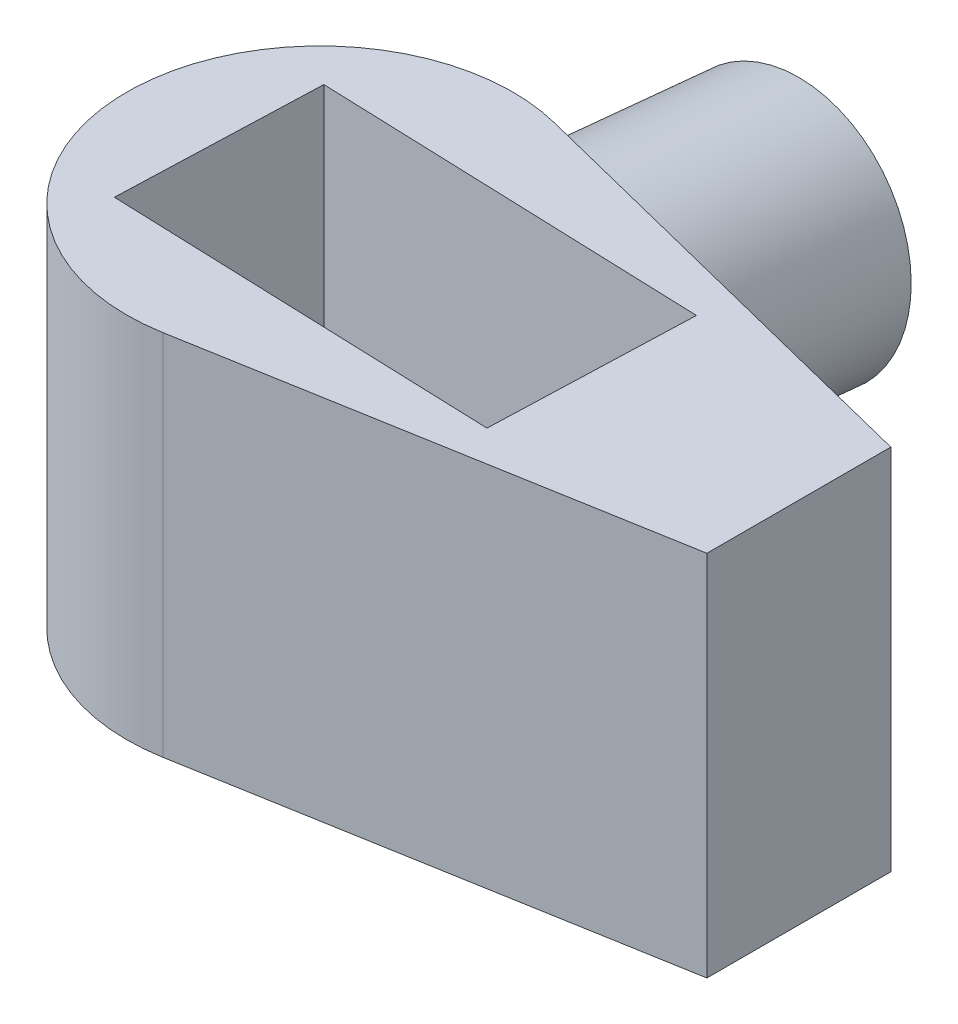
from build123d import *

# Parameters (mm, degrees)
CROQUIS1_R              = 21
SALIENTE_EXTRUIR1_DEPTH = 40
SALIENTE_EXTRUIR2_DEPTH = 40
SALIENTE_EXTRUIR3_REACH = 77.493
CROQUIS3_R              = 13.5
CROQUIS3_R_2            = 10
CROQUIS7_R              = 8.227269221
CROQUIS7_R_2            = 6
CORTAR_EXTRUIR6_DEPTH   = 6
CROQUIS8_R              = 6
CORTAR_EXTRUIR7_DEPTH   = 72.223648425
CORTAR_EXTRUIR8_START   = -25
CORTAR_EXTRUIR8_DEPTH   = 25
CROQUIS12_R             = 9.55
CORTAR_EXTRUIR9_DEPTH   = 5.5


with BuildPart() as part:
    # Croquis1 → Saliente-Extruir1 (new body)
    with BuildSketch(Plane(origin=(0, 0, 0), x_dir=(1, 0, 0), z_dir=(0, 1, 0))):
        with Locations(Location((0, 0, 0), (0, 0, 270))):
            Circle(CROQUIS1_R)
    extrude(amount=SALIENTE_EXTRUIR1_DEPTH)

    # Croquis2 → Saliente-Extruir2 (add)
    with BuildSketch(Plane(origin=(0, 0, 0), x_dir=(1, 0, 0), z_dir=(0, 1, 0))):
        with BuildLine():
            Line((53.975127576, 8.110971331), (53.975127576, -11.889028669))
            Line((53.975127576, -11.889028669), (3.613793412, -20.686722727))
            ThreePointArc((3.613793412, -20.686722727), (20.98607707, -0.764571273), (5.109545014, 20.368911354))
            Line((5.109545014, 20.368911354), (53.975127576, 8.110971331))
        make_face()
    extrude(amount=SALIENTE_EXTRUIR2_DEPTH)

    # Croquis3 → Saliente-Extruir3 (add, up to next)
    with BuildSketch(Plane(origin=(5.109545014, 0, -20.368911354), x_dir=(-0.9699481597219111, 0, -0.24331166731597212), z_dir=(0.2433116673159721, 0, -0.969948159721911)), mode=Mode.PRIVATE) as saliente_extruir3_sk1:
        with Locations((0, 20)):
            Circle(CROQUIS3_R)
        with Locations((0, 20)):
            Circle(CROQUIS3_R_2, mode=Mode.SUBTRACT)
    saliente_extruir3_tool1 = extrude(saliente_extruir3_sk1.sketch, amount=-SALIENTE_EXTRUIR3_REACH, mode=Mode.PRIVATE) - part.part
    add(saliente_extruir3_tool1.solids().sort_by_distance((17.833482, 20, -17.177109))[0])

    # Croquis7 → Cortar-Extruir6 (cut)
    with BuildSketch(Plane.XZ):
        with Locations(Location((0, 0, 0), (0, 0, 270))):
            Circle(CROQUIS7_R)
        with Locations(Location((0, 0, 0), (0, 0, 270))):
            Circle(CROQUIS7_R_2, mode=Mode.SUBTRACT)
    extrude(amount=-CORTAR_EXTRUIR6_DEPTH, mode=Mode.SUBTRACT)

    # Croquis8 → Cortar-Extruir7 (cut, through all)
    with BuildSketch(Plane.XZ):
        with Locations(Location((0, 0, 0), (0, 0, 270))):
            Circle(CROQUIS8_R)
    extrude(amount=-CORTAR_EXTRUIR7_DEPTH, mode=Mode.SUBTRACT)

    # Croquis10 → Cortar-Extruir8 (cut)
    with BuildSketch(Plane(origin=(0, 40, 0), x_dir=(1, 0, 0), z_dir=(0, 1, 0)).offset(CORTAR_EXTRUIR8_START)):
        with BuildLine():
            Line((-5.995438853, 0.23390802), (-11.37823559, 0.424457107))
            Line((-11.37823559, 0.424457107), (-11.767631672, -10.575542893))
            Line((-11.767631672, -10.575542893), (30.232368328, -12.062327932))
            Line((30.232368328, -12.062327932), (30.62176441, -1.062327932))
            Line((30.62176441, -1.062327932), (5.996971268, -0.190619027))
            ThreePointArc((5.996971268, -0.190619027), (-0.212264906, -5.996244125), (-5.995438853, 0.23390802))
        make_face()
        with BuildLine():
            Line((-10.988839509, 11.424457107), (-11.37823559, 0.424457107))
            Line((-11.37823559, 0.424457107), (-5.995438853, 0.23390802))
            ThreePointArc((-5.995438853, 0.23390802), (0.116976243, 5.998859605), (6, 0))
            ThreePointArc((6, 0), (5.999242769, -0.095321543), (5.996971268, -0.190619027))
            Line((5.996971268, -0.190619027), (30.62176441, -1.062327932))
            Line((30.62176441, -1.062327932), (31.011160491, 9.937672068))
            Line((31.011160491, 9.937672068), (-10.988839509, 11.424457107))
        make_face()
    extrude(amount=CORTAR_EXTRUIR8_DEPTH, mode=Mode.SUBTRACT)

    # Croquis12 → Cortar-Extruir9 (cut)
    with BuildSketch(Plane(origin=(0, 15, 0), x_dir=(1, 0, 0), z_dir=(0, 1, 0))):
        with Locations(Location((0, 0, 0), (0, 0, 270))):
            Circle(CROQUIS12_R)
    extrude(amount=-CORTAR_EXTRUIR9_DEPTH, mode=Mode.SUBTRACT)

    # Croquis4 → Revolución1 (revolve)
    with BuildSketch(Plane(origin=(5.1, 0, 0), x_dir=(0, 0, -1), z_dir=(1, 0, 0))):
        Polygon((20.368911354, 6.46), (14.136824823, 7.062482259), (14.475882844, 10.569704081), (20.368911354, 10), (44.36703003, 7.68), (44.36703003, 4.14), align=None)
    revolve(axis=Axis((5.1, 20, -20.368911354), (0, -0.09622563251762795, -0.9953595469209016)))


solid = part.part
